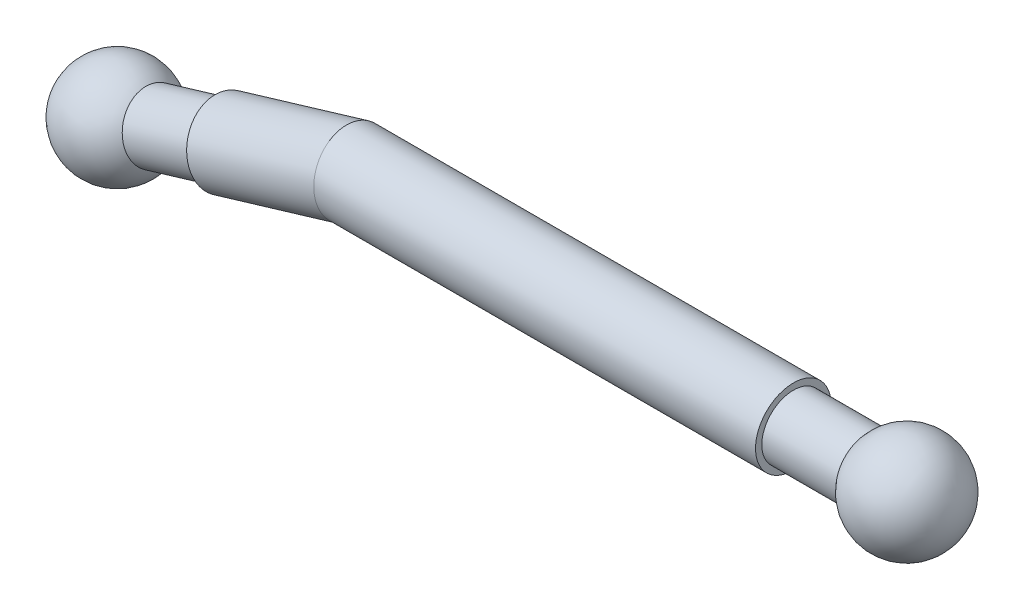
from build123d import *

# Parameters (mm, degrees)
SKETCH1_R           = 3
SKETCH3_R           = 2.5
BOSS_EXTRUDE1_DEPTH = 6
SKETCH5_R           = 2.5
BOSS_EXTRUDE2_DEPTH = 6


with BuildPart() as part:
    # Sweep2: sweep along a path in Sketch2
    with BuildLine(Plane.XY) as sweep2_path:
        Line((0, 0), (-35, 0))
        Line((-35, 0), (-45, -3))
    # Sketch1 → Sweep2 (sweep)
    with BuildSketch(Plane(origin=(0, 0, 0), x_dir=(0, 0, -1), z_dir=(1, 0, 0))):
        Circle(SKETCH1_R)
    sweep(path=sweep2_path.line, transition=Transition.RIGHT)

    # Sketch3 → Boss-Extrude1 (add)
    with BuildSketch(Plane(origin=(-42.110091743, -12.633027523, 0), x_dir=(0, 0, 1), z_dir=(-0.9578262852211515, -0.2873478855663453, 0))):
        with Locations(Location((0, 10.057175995, 0), (0, 0, 270))):
            Circle(SKETCH3_R)
    extrude(amount=BOSS_EXTRUDE1_DEPTH)

    # Sketch4 → Revolve1 (revolve)
    with BuildSketch(Plane(origin=(-50.73052831, -15.219158493, 0), x_dir=(0, 0, 1), z_dir=(-0.9578262852211515, -0.28734788556634533, 0))):
        with BuildLine():
            Line((0, 14.057175995), (0, 6.057175995))
            ThreePointArc((0, 6.057175995), (4, 10.057175995), (0, 14.057175995))
        make_face()
    revolve(axis=Axis((-54.769828109, -1.754825829, 0), (0.28734788556634544, -0.9578262852211514, 0)))

    # Sketch5 → Boss-Extrude2 (add)
    with BuildSketch(Plane(origin=(0, 0, 0), x_dir=(0, 0, -1), z_dir=(1, 0, 0))):
        Circle(SKETCH5_R)
    extrude(amount=BOSS_EXTRUDE2_DEPTH)

    # Sketch6 → Revolve2 (revolve)
    with BuildSketch(Plane(origin=(9, 0, 0), x_dir=(0, 0, -1), z_dir=(1, 0, 0))):
        with BuildLine():
            Line((0, 4), (0, -4))
            ThreePointArc((0, -4), (4, 0), (0, 4))
        make_face()
    revolve(axis=Axis((9, 4, 0), (0, -1, 0)))


solid = part.part
